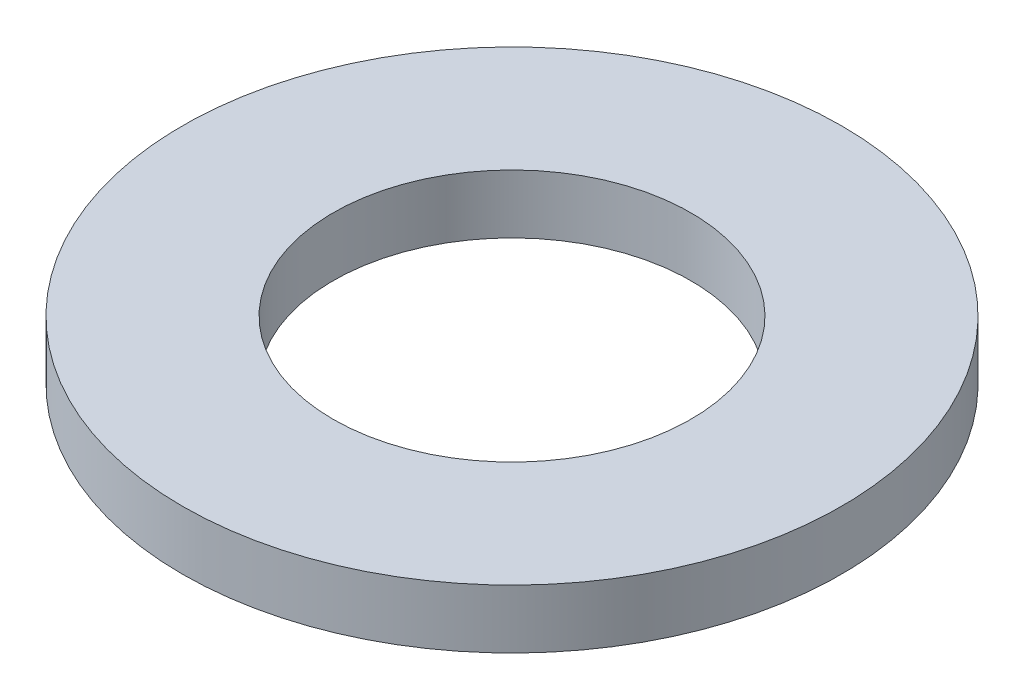
from build123d import *

# Parameters (mm, degrees)
SKETCH1_R           = 17.78
SKETCH1_R_2         = 9.652
BOSS_EXTRUDE1_DEPTH = 3.175


with BuildPart() as part:
    # Sketch1 → Boss-Extrude1 (new body)
    with BuildSketch(Plane(origin=(0, 0, 0), x_dir=(1, 0, 0), z_dir=(0, 1, 0))):
        with Locations(Location((0, 0, 0), (0, 0, 270))):
            Circle(SKETCH1_R)
        with Locations(Location((0, 0, 0), (0, 0, 270))):
            Circle(SKETCH1_R_2, mode=Mode.SUBTRACT)
    extrude(amount=BOSS_EXTRUDE1_DEPTH)


solid = part.part
